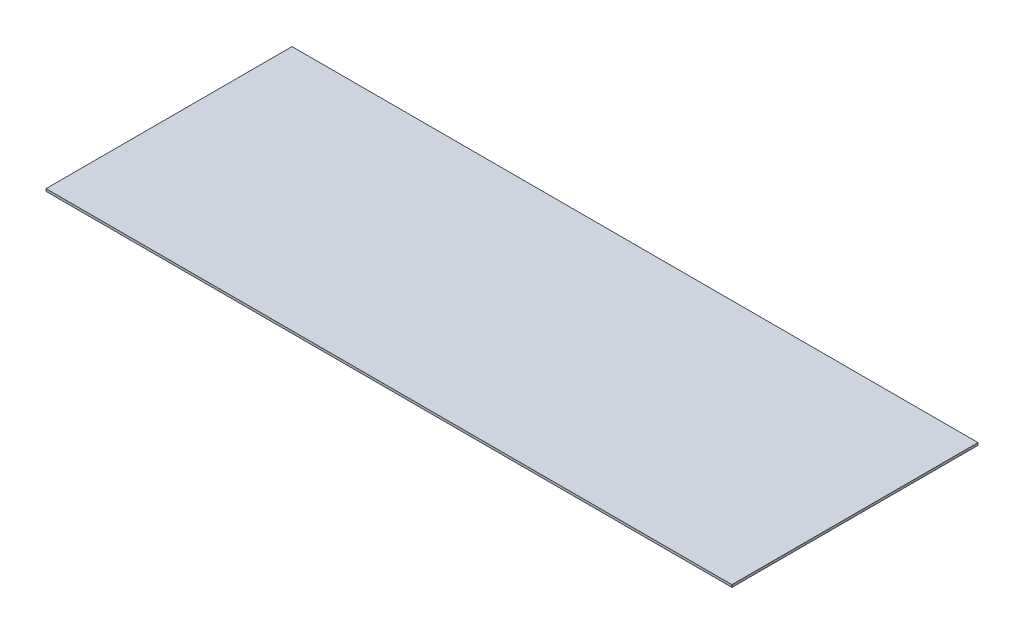
from build123d import *

# Parameters (mm, degrees)
SKETCH1_W           = 57.15
SKETCH1_H           = 20.5
BOSS_EXTRUDE1_DEPTH = 0.2


with BuildPart() as part:
    # Sketch1 → Boss-Extrude1 (new body)
    with BuildSketch(Plane(origin=(0, 0, 0), x_dir=(1, 0, 0), z_dir=(0, 1, 0))):
        Rectangle(SKETCH1_W, SKETCH1_H)
    extrude(amount=BOSS_EXTRUDE1_DEPTH)


solid = part.part
